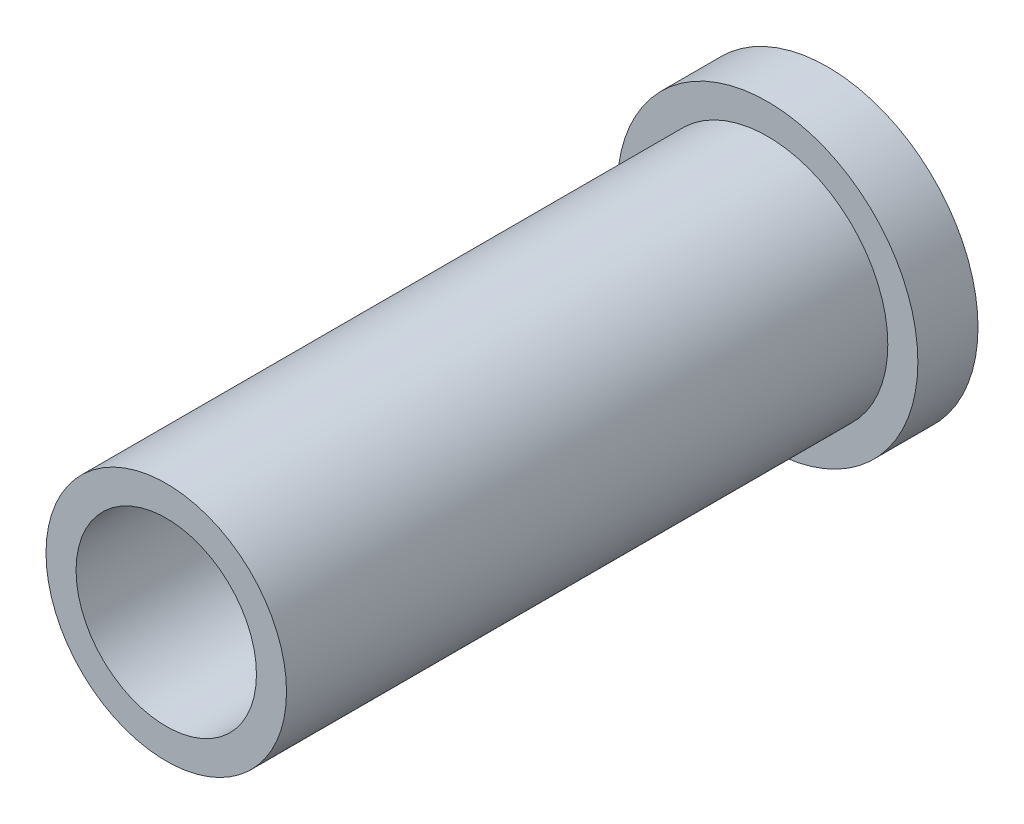
from build123d import *

# Parameters (mm, degrees)
ESBO_O1_R                = 7.5
RESSALTO_EXTRUS_O1_DEPTH = 3
ESBO_O2_R                = 6
ESBO_O2_R_2              = 4.5
RESSALTO_EXTRUS_O2_DEPTH = 30


with BuildPart() as part:
    # Esboço1 → Ressalto-extrusão1 (new body)
    with BuildSketch(Plane.XY):
        Circle(ESBO_O1_R)
    extrude(amount=RESSALTO_EXTRUS_O1_DEPTH)

    # Esboço2 → Ressalto-extrusão2 (add)
    with BuildSketch(Plane.XY.offset(3)):
        Circle(ESBO_O2_R)
        Circle(ESBO_O2_R_2, mode=Mode.SUBTRACT)
    extrude(amount=RESSALTO_EXTRUS_O2_DEPTH)


solid = part.part
